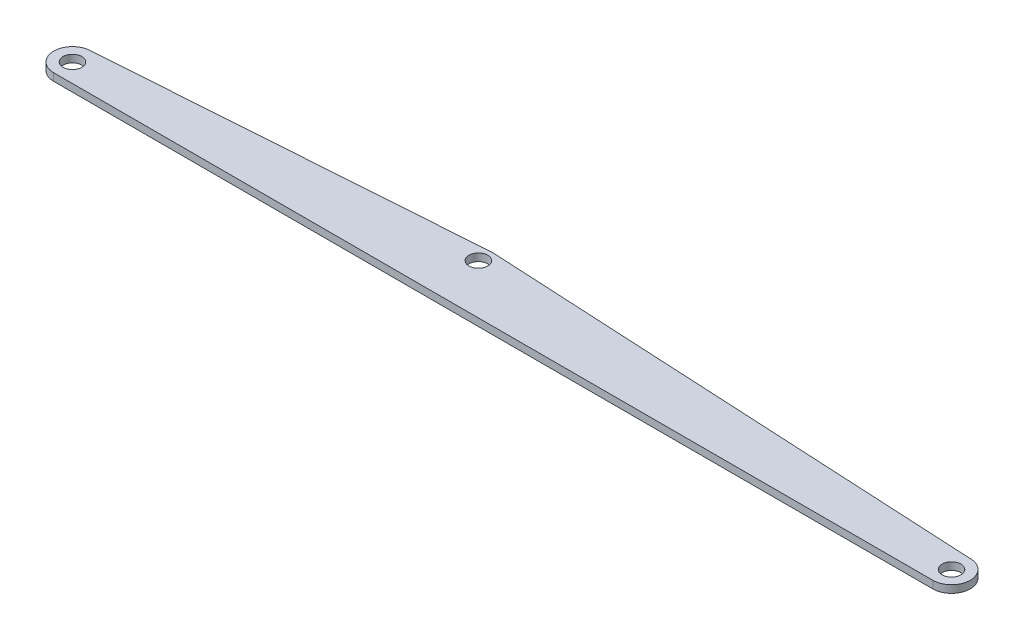
from build123d import *

# Parameters (mm, degrees)
SKETCH2_R           = 6.35
BOSS_EXTRUDE1_DEPTH = 5.08


with BuildPart() as part:
    # Sketch2 → Boss-Extrude1 (new body)
    with BuildSketch(Plane(origin=(0, 0, 0), x_dir=(1, 0, 0), z_dir=(0, 1, 0))):
        with BuildLine():
            Line((-595.5, -12.7), (0, -12.7))
            ThreePointArc((0, -12.7), (12.7, 0), (0, 12.7))
            Line((0, 12.7), (-340.965168315, 30.430994835))
            ThreePointArc((-340.965168315, 30.430994835), (-341.544922169, 30.443467581), (-342.124360605, 30.420637788))
            Line((-342.124360605, 30.420637788), (-595.5, 12.7))
            ThreePointArc((-595.5, 12.7), (-608.2, 0), (-595.5, -12.7))
        make_face()
        with Locations(Location((0, 0, 0), (0, 0, 270))):
            Circle(SKETCH2_R, mode=Mode.SUBTRACT)
        with Locations(Location((-595.5, 0, 0), (0, 0, 270))):
            Circle(SKETCH2_R, mode=Mode.SUBTRACT)
        with Locations(Location((-341.459822451, 20.918847744, 0), (0, 0, 270))):
            Circle(SKETCH2_R, mode=Mode.SUBTRACT)
    extrude(amount=-BOSS_EXTRUDE1_DEPTH)


solid = part.part
